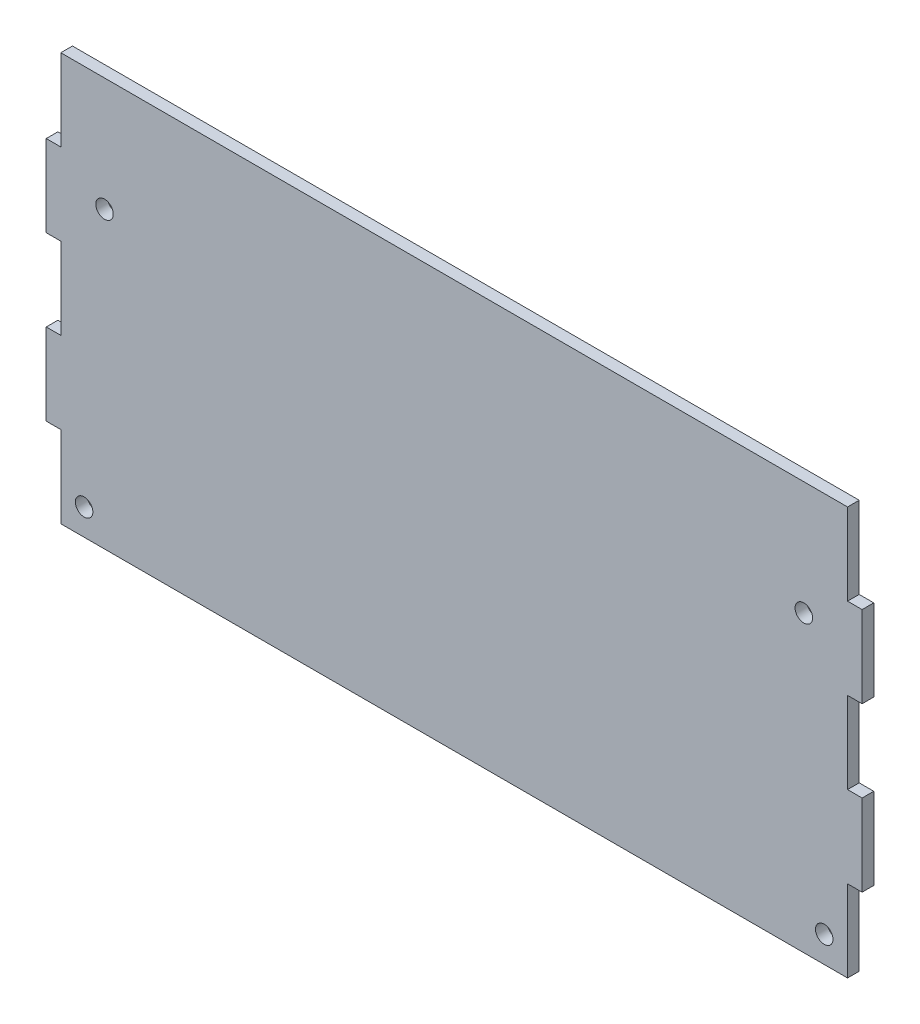
from build123d import *

# Parameters (mm, degrees)
SKETCH1_W           = 270
SKETCH1_H           = 110
BOSS_EXTRUDE1_DEPTH = 4
SKETCH9_R           = 3
CUT_EXTRUDE1_DEPTH  = 146.828666592
SKETCH10_W          = 270
SKETCH10_H          = 4
BOSS_EXTRUDE2_DEPTH = 30
ESQUISSE1_W         = 4
ESQUISSE1_H         = 28
BOSS_EXTRU_1_DEPTH  = 5


with BuildPart() as part:
    # Sketch1 → Boss-Extrude1 (new body)
    with BuildSketch(Plane.XY):
        Rectangle(SKETCH1_W, SKETCH1_H)
    extrude(amount=BOSS_EXTRUDE1_DEPTH)

    # Sketch9 → Cut-Extrude1 (cut, through all)
    with BuildSketch(Plane(origin=(0, 0, 0), x_dir=(-1, 0, 0), z_dir=(0, 0, -1))):
        with Locations((-120, 46)):
            Circle(SKETCH9_R)
        with Locations((-127, -46)):
            Circle(SKETCH9_R)
        with Locations((120, 46)):
            Circle(SKETCH9_R)
        with Locations((127, -46)):
            Circle(SKETCH9_R)
    extrude(amount=-CUT_EXTRUDE1_DEPTH, mode=Mode.SUBTRACT)

    # Sketch10 → Boss-Extrude2 (add)
    with BuildSketch(Plane(origin=(0, 55, 0), x_dir=(1, 0, 0), z_dir=(0, 1, 0))):
        with Locations((0, -2)):
            Rectangle(SKETCH10_W, SKETCH10_H)
    extrude(amount=BOSS_EXTRUDE2_DEPTH)

    # Esquisse1 → Boss.-Extru.1 (add)
    with BuildSketch(Plane(origin=(135, 0, 0), x_dir=(0, 0, -1), z_dir=(1, 0, 0))):
        with Locations((-2, -13)):
            Rectangle(ESQUISSE1_W, ESQUISSE1_H)
        with Locations((-2, 43)):
            Rectangle(ESQUISSE1_W, ESQUISSE1_H)
    boss_extru_1 = extrude(amount=BOSS_EXTRU_1_DEPTH)

    # Symétrie1: Boss.-Extru.1 across plane
    add(boss_extru_1.mirror(Plane(origin=(0, 0, 0), x_dir=(0, 0, 1), z_dir=(1, 0, 0))))


solid = part.part
